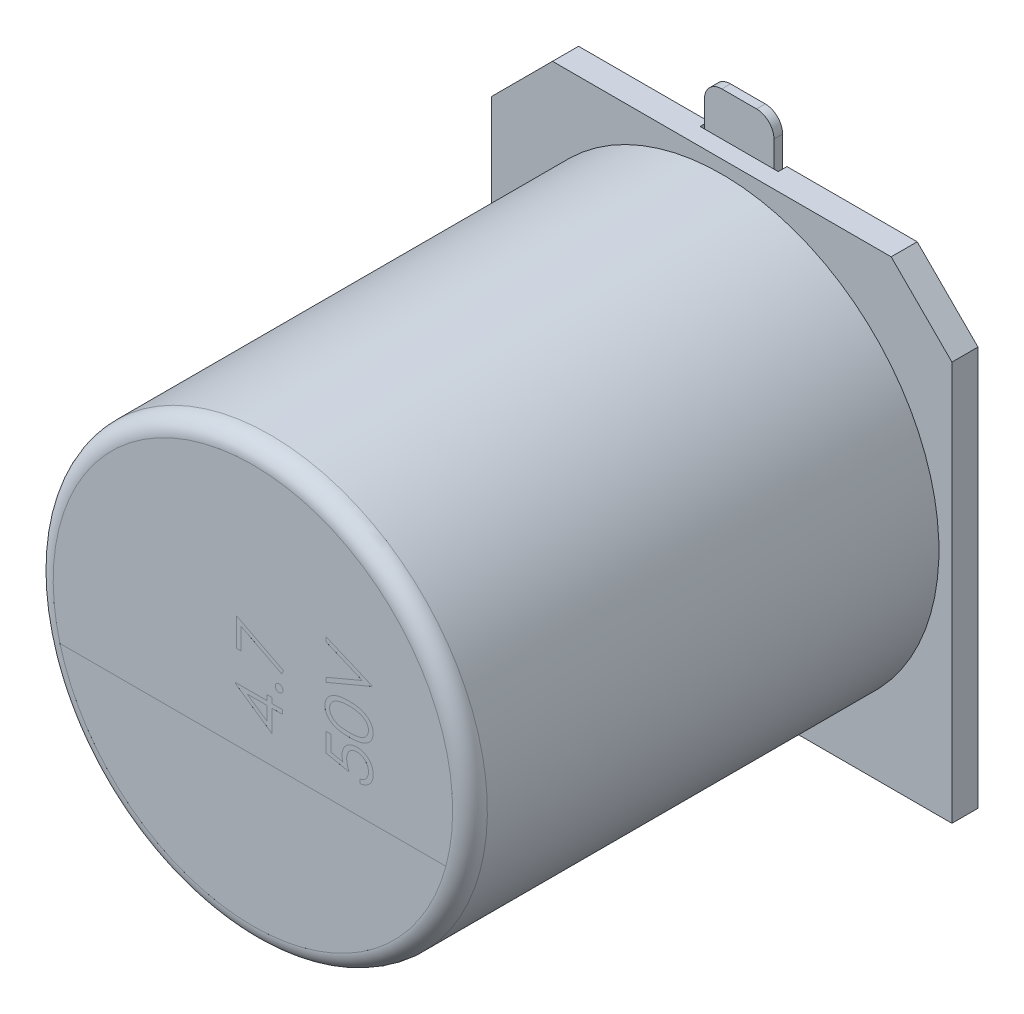
from build123d import *

# Parameters (mm, degrees)
RESSALTO_EXTRUS_O1_DEPTH   = 0.3
ESBO_O2_R                  = 2.5
RESSALTO_EXTRUS_O2_DEPTH   = 5.4
FILETE1_R                  = 0.2
CORTE_EXTRUS_O1_DEPTH      = 0.0001
CORTE_EXTRUS_O2_DEPTH      = 0.0001
ESBO_O5_W                  = 0.9
ESBO_O5_H                  = 2.1
CORTE_EXTRUS_O3_DEPTH      = 0.1
RESSALTO_EXTRUS_O3_DEPTH   = 0.1
RESSALTO_EXTRUS_O3_2_DEPTH = 0.1


with BuildPart() as part:
    # Esboço1 → Ressalto-extrusão1 (new body)
    with BuildSketch(Plane.XY):
        Polygon((-2.65, 1.95), (-1.95, 2.65), (1.95, 2.65), (2.65, 1.95), (2.65, -2.65), (-2.65, -2.65), align=None)
    extrude(amount=RESSALTO_EXTRUS_O1_DEPTH)

    # Esboço5 → Corte-extrusão3 (cut)
    with BuildSketch(Plane(origin=(0, 0, 0), x_dir=(-1, 0, 0), z_dir=(0, 0, -1))):
        with Locations((0, 2.1)):
            Rectangle(ESBO_O5_W, ESBO_O5_H)
        with Locations((0, -2.1)):
            Rectangle(ESBO_O5_W, ESBO_O5_H)
    extrude(amount=-CORTE_EXTRUS_O3_DEPTH, mode=Mode.SUBTRACT)


with BuildPart() as body_2:
    # Esboço2 → Ressalto-extrusão2 (new body)
    with BuildSketch(Plane.XY.offset(0.3)):
        with Locations(Location((0, 0, 0), (0, 0, 180))):
            Circle(ESBO_O2_R)
    extrude(amount=RESSALTO_EXTRUS_O2_DEPTH)

    # Filete1
    filete1_edges = [body_2.edges().sort_by_distance(p)[0] for p in [
        (2.5, 0, 5.7),
    ]]
    fillet(filete1_edges, radius=FILETE1_R)

    # Esboço3 → Corte-extrusão1 (cut)
    with BuildSketch(Plane.XY.offset(5.7)):
        with BuildLine():
            Line((-2.222466614, -0.592150444), (2.222466614, -0.592150444))
            ThreePointArc((2.222466614, -0.592150444), (0, -2.3), (-2.222466614, -0.592150444))
        make_face()
    extrude(amount=-CORTE_EXTRUS_O1_DEPTH, mode=Mode.SUBTRACT)

    # Esboço4 → Corte-extrusão2 (cut)
    # profile 1 of 6: a face of its own
    with BuildSketch(Plane.XY.offset(5.7)):
        Polygon((-0.203365217, 0.020093001), (-0.203365217, 0.029739268), (0.162980937, 0.029739268), (0.162980937, 0.090796961), (0.217254441, 0.090796961), (0.217254441, 0.029739268), (0.339369825, 0.029739268), (0.339369825, -0.017750048), (0.217254441, -0.017750048), (0.217254441, -0.268765005), align=None)
        Polygon((0.162980937, -0.017750048), (-0.066833433, -0.017750048), (0.162980937, -0.17548242), align=None, mode=Mode.SUBTRACT)
    # profile 2 of 6: a face of its own
    with BuildSketch(Plane.XY.offset(5.7)):
        with BuildLine():
            add(Edge.make_bspline(
                [(0.257959569, 0.223088627), (0.258134673, 0.226035362), (0.258477943, 0.23181209), (0.260832988, 0.24016372), (0.265014714, 0.247722437), (0.270588015, 0.254455288), (0.277345574, 0.260004958), (0.284844003, 0.264335711), (0.293265553, 0.266670241), (0.299075754, 0.267011011), (0.302056791, 0.267185849)],
                knots=[0, 0, 0, 0, 1.020151414, 1.999887582, 2.974338812, 3.990962822, 5.007586832, 5.987933904, 6.967670073, 8, 8, 8, 8], degree=3))
            add(Edge.make_bspline(
                [(0.302056791, 0.267185849), (0.304966699, 0.267005643), (0.310704994, 0.266650278), (0.319055795, 0.264334657), (0.326562824, 0.260010215), (0.333304543, 0.254419978), (0.339012458, 0.247762701), (0.343138744, 0.240140072), (0.345670514, 0.231833209), (0.345990876, 0.226039143), (0.346154014, 0.223088627)],
                knots=[0, 0, 0, 0, 1.009624703, 1.990965087, 2.972917375, 3.991206001, 5.017354006, 5.993400798, 6.978178195, 8, 8, 8, 8], degree=3))
            add(Edge.make_bspline(
                [(0.346154014, 0.223088627), (0.345996798, 0.220135986), (0.345689871, 0.214371658), (0.343086996, 0.206095765), (0.339051833, 0.198426675), (0.333294152, 0.191771129), (0.326597696, 0.186135591), (0.319004095, 0.182003004), (0.310728926, 0.17948661), (0.304971413, 0.179157839), (0.302056791, 0.178991405)],
                knots=[0, 0, 0, 0, 1.022258411, 1.995716197, 2.98297171, 4.009558169, 5.028281891, 6.00474573, 6.989943903, 8, 8, 8, 8], degree=3))
            add(Edge.make_bspline(
                [(0.302056791, 0.178991405), (0.299070873, 0.179151984), (0.293241235, 0.179465496), (0.284895655, 0.182001816), (0.277310665, 0.186140838), (0.270598325, 0.191735701), (0.264975959, 0.198467351), (0.26088402, 0.206071658), (0.258458862, 0.214393112), (0.258128887, 0.220139853), (0.257959569, 0.223088627)],
                knots=[0, 0, 0, 0, 1.032775665, 2.016367738, 2.991239715, 4.008302682, 5.025365648, 6.011011707, 6.979408107, 8, 8, 8, 8], degree=3))
        make_face()
    # profile 3 of 6: a face of its own
    with BuildSketch(Plane.XY.offset(5.7)):
        Polygon((-0.189796841, 0.375732858), (-0.189796841, 0.701373884), (0.352938202, 0.423222174), (0.330359576, 0.382199037), (-0.135523337, 0.621023657), (-0.135523337, 0.375732858), align=None)
    # profile 4 of 6: a face of its own
    with BuildSketch(Plane.XY.offset(5.7)):
        with BuildLine():
            Line((0.842444364, 0.063660208), (0.896717868, 0.063660208))
            Line((0.896717868, 0.063660208), (0.896717868, -0.11633278))
            Line((0.896717868, -0.11633278), (1.035899726, -0.144847571))
            add(Edge.make_bspline(
                [(1.035899726, -0.144847571), (1.034353006, -0.139245075), (1.031356482, -0.128391127), (1.028029419, -0.112371005), (1.02602381, -0.097162422), (1.025749957, -0.087293408), (1.025617441, -0.082517843)],
                knots=[0, 0, 0, 0, 1.100273476, 2.13160584, 3.095893838, 4, 4, 4, 4], degree=3))
            add(Edge.make_bspline(
                [(1.025617441, -0.082517843), (1.025741115, -0.076607669), (1.025984288, -0.064986791), (1.02845794, -0.048010473), (1.032040823, -0.031723126), (1.037560934, -0.01636523), (1.044301973, -0.001693809), (1.05279246, 0.012039174), (1.062705081, 0.025026463), (1.073988787, 0.037178294), (1.086536178, 0.048150641), (1.100082924, 0.057685248), (1.114333412, 0.066007191), (1.129621644, 0.07249756), (1.145659278, 0.077794334), (1.162631445, 0.08128704), (1.180387467, 0.083620017), (1.192528895, 0.083880131), (1.198720239, 0.084012772)],
                knots=[0, 0, 0, 0, 1.052805225, 2.070078116, 3.052532748, 4.020689046, 4.973125432, 5.925915817, 6.89216474, 7.881560752, 8.877013184, 9.857446635, 10.830895175, 11.812622661, 12.812548702, 13.836681939, 14.896847428, 16, 16, 16, 16], degree=3))
            add(Edge.make_bspline(
                [(1.198720239, 0.084012772), (1.2030325, 0.083912129), (1.211598746, 0.083712202), (1.224320942, 0.082697743), (1.236771949, 0.080737046), (1.248928938, 0.078136552), (1.260803296, 0.074665021), (1.272461506, 0.070604435), (1.283775913, 0.065557394), (1.294796487, 0.059962186), (1.305397101, 0.053766548), (1.315323587, 0.046799691), (1.324802469, 0.039560724), (1.333552239, 0.031650817), (1.341606835, 0.023159901), (1.349006078, 0.014135219), (1.355882762, 0.004658627), (1.361955718, -0.00541913), (1.36754419, -0.015872782), (1.372128813, -0.026853486), (1.376227669, -0.038111232), (1.379494823, -0.049808065), (1.382054864, -0.061917487), (1.383793646, -0.074459459), (1.385060083, -0.087368203), (1.385139361, -0.096118354), (1.385179407, -0.100538343)],
                knots=[0, 0, 0, 0, 1.056393913, 2.098511576, 3.122979385, 4.141471433, 5.141222888, 6.151259816, 7.162667642, 8.172852865, 9.177685681, 10.166741883, 11.141342384, 12.097242845, 13.052202613, 14.005160326, 14.953864445, 15.917140761, 16.884916217, 17.854238259, 18.828761908, 19.81781811, 20.826036654, 21.857789401, 22.917898972, 24, 24, 24, 24], degree=3))
            add(Edge.make_bspline(
                [(1.385179407, -0.100538343), (1.385074678, -0.105810852), (1.384868636, -0.116183892), (1.38272294, -0.131383561), (1.379629488, -0.145998889), (1.37504637, -0.159967238), (1.369045104, -0.173230351), (1.361914692, -0.185978154), (1.353426046, -0.198052642), (1.343656808, -0.209371266), (1.332922474, -0.219775591), (1.321385167, -0.229210309), (1.309030195, -0.237505169), (1.295897732, -0.244690258), (1.282011072, -0.2508113), (1.267327427, -0.25562194), (1.251920999, -0.259504121), (1.241314473, -0.261146586), (1.23592727, -0.261980817)],
                knots=[0, 0, 0, 0, 1.046872515, 2.059598001, 3.044168548, 4.012104806, 4.973680974, 5.932408326, 6.910122221, 7.900780896, 8.89867654, 9.876692837, 10.858029398, 11.85084981, 12.847361615, 13.868568023, 14.917415949, 16, 16, 16, 16], degree=3))
            Line((1.23592727, -0.261980817), (1.23592727, -0.214491501))
            add(Edge.make_bspline(
                [(1.23592727, -0.214491501), (1.240973997, -0.213323748), (1.250674087, -0.211079261), (1.264294096, -0.206139854), (1.276435474, -0.200159218), (1.287172456, -0.192881825), (1.29670158, -0.184446395), (1.305103388, -0.174640644), (1.312692514, -0.163709711), (1.319029286, -0.151556661), (1.324367161, -0.138710299), (1.328176444, -0.125341569), (1.330482285, -0.111642872), (1.330764165, -0.102419857), (1.330905902, -0.097782266)],
                knots=[0, 0, 0, 0, 1.13623081, 2.183898708, 3.172478118, 4.09966615, 5.022692284, 5.957376522, 6.927682873, 7.937366477, 8.960015386, 9.976409503, 10.982481913, 12, 12, 12, 12], degree=3))
            add(Edge.make_bspline(
                [(1.330905902, -0.097782266), (1.33078077, -0.093253219), (1.330534384, -0.084335488), (1.328668617, -0.071204922), (1.325719642, -0.058564906), (1.321588298, -0.046393003), (1.316122772, -0.034749023), (1.309408687, -0.023649429), (1.301613556, -0.012936098), (1.292704005, -0.002890989), (1.282880098, 0.006306872), (1.272376067, 0.014434412), (1.26117023, 0.021204222), (1.249457047, 0.026909268), (1.237108022, 0.031241372), (1.22418106, 0.034331854), (1.210644223, 0.036146602), (1.201411125, 0.036396245), (1.196706183, 0.036523456)],
                knots=[0, 0, 0, 0, 1.027268864, 2.022700798, 3.002744649, 3.968653148, 4.933396556, 5.915045722, 6.907600446, 7.935526002, 8.956456544, 9.95700807, 10.942805781, 11.92166854, 12.907987664, 13.905483474, 14.932689774, 16, 16, 16, 16], degree=3))
            add(Edge.make_bspline(
                [(1.196706183, 0.036523456), (1.192460895, 0.036426925), (1.18418639, 0.036238777), (1.172038136, 0.034609986), (1.160525166, 0.031889117), (1.149597383, 0.028015151), (1.139289726, 0.023180319), (1.129624911, 0.01711004), (1.120512064, 0.010062793), (1.112185695, 0.001835292), (1.104488742, -0.007114526), (1.097951086, -0.017016539), (1.092391341, -0.027606398), (1.087836113, -0.038903729), (1.084207525, -0.050922448), (1.081699758, -0.063669027), (1.080199148, -0.077146372), (1.079995583, -0.086365308), (1.079890945, -0.091104081)],
                knots=[0, 0, 0, 0, 1.045723156, 2.038222538, 3.013889863, 3.95567481, 4.890389958, 5.81331128, 6.76251276, 7.723027653, 8.692928204, 9.666105983, 10.639751036, 11.635719707, 12.66315958, 13.728667616, 14.832476222, 16, 16, 16, 16], degree=3))
            add(Edge.make_bspline(
                [(1.079890945, -0.091104081), (1.079978725, -0.095205717), (1.080159968, -0.103674554), (1.08149445, -0.116665267), (1.083647296, -0.130316516), (1.08660855, -0.144575969), (1.090483725, -0.159486451), (1.095127465, -0.175016495), (1.100679481, -0.191198754), (1.104872328, -0.202102267), (1.107027697, -0.207707313)],
                knots=[0, 0, 0, 0, 0.817624296, 1.688186739, 2.600797293, 3.572016777, 4.590301741, 5.671205678, 6.80286297, 8, 8, 8, 8], degree=3))
            Line((1.107027697, -0.207707313), (0.842444364, -0.153433809))
            Line((0.842444364, -0.153433809), (0.842444364, 0.063660208))
        make_face()
    # profile 5 of 6: a face of its own
    with BuildSketch(Plane.XY.offset(5.7)):
        with BuildLine():
            add(Edge.make_bspline(
                [(1.107239703, 0.138286277), (1.098758312, 0.13833587), (1.082283089, 0.138432206), (1.058276363, 0.139503907), (1.035754986, 0.141284227), (1.01471788, 0.143724044), (0.995159613, 0.146693119), (0.977132454, 0.150656652), (0.960552962, 0.15516406), (0.945367095, 0.160388074), (0.93137018, 0.166282612), (0.918303681, 0.172698425), (0.906186386, 0.179889212), (0.894828405, 0.187447235), (0.884403204, 0.195666727), (0.874790666, 0.204371446), (0.866071856, 0.213735488), (0.858240803, 0.22366803), (0.851374112, 0.234101754), (0.845288446, 0.244751547), (0.840275716, 0.255807695), (0.836175164, 0.267124652), (0.832827789, 0.278726269), (0.830528486, 0.290609584), (0.82908434, 0.302802144), (0.828946098, 0.31103161), (0.828875988, 0.31520518)],
                knots=[0, 0, 0, 0, 1.646148282, 3.197666765, 4.66315463, 6.030252048, 7.307778049, 8.501004361, 9.610818041, 10.641065266, 11.615491391, 12.557119604, 13.464013759, 14.348536654, 15.203310953, 16.038349431, 16.863300206, 17.683791446, 18.490318933, 19.285717724, 20.06220424, 20.843281102, 21.620494212, 22.403315558, 23.190242141, 24, 24, 24, 24], degree=3))
            add(Edge.make_bspline(
                [(0.828875988, 0.31520518), (0.828934385, 0.319415681), (0.829050575, 0.327793094), (0.830686021, 0.340134039), (0.832796937, 0.352260026), (0.8361825, 0.363987079), (0.840233765, 0.375536935), (0.845579344, 0.386622372), (0.851393077, 0.397634765), (0.858485342, 0.408073835), (0.866323462, 0.418251482), (0.875221732, 0.427791963), (0.884933892, 0.43693916), (0.89567655, 0.445347585), (0.907284991, 0.453377612), (0.919856526, 0.460724413), (0.933363295, 0.467540788), (0.947742682, 0.473954867), (0.963378785, 0.47956381), (0.980174075, 0.484550608), (0.998280642, 0.488638133), (1.017597622, 0.492018445), (1.038220711, 0.49464221), (1.060108122, 0.496551742), (1.083273551, 0.497560763), (1.099111945, 0.497750748), (1.107239703, 0.497848243)],
                knots=[0, 0, 0, 0, 0.810910589, 1.61342667, 2.396193133, 3.181089899, 3.963115317, 4.752255436, 5.550715454, 6.36105385, 7.181178335, 8.024612154, 8.872680183, 9.750181803, 10.651284446, 11.591556747, 12.554036451, 13.566402641, 14.62422919, 15.753422176, 16.94128843, 18.199818041, 19.531985927, 20.947085226, 22.433341622, 24, 24, 24, 24], degree=3))
            add(Edge.make_bspline(
                [(1.107239703, 0.497848243), (1.115331938, 0.497748603), (1.131134621, 0.497554026), (1.154196903, 0.496573382), (1.175966337, 0.494595569), (1.196466132, 0.492157664), (1.215705794, 0.488739572), (1.233672785, 0.484621052), (1.250430717, 0.479928612), (1.265859521, 0.474233587), (1.280213956, 0.467968801), (1.293621411, 0.46115974), (1.306189626, 0.453854399), (1.317828685, 0.445944803), (1.328528225, 0.437398069), (1.338273695, 0.428257284), (1.347228562, 0.418633502), (1.355153035, 0.408396521), (1.362299297, 0.397860218), (1.368324007, 0.386846707), (1.373544064, 0.375637853), (1.377811943, 0.364121747), (1.381121733, 0.352316168), (1.383397033, 0.34018187), (1.384996394, 0.327791352), (1.385118191, 0.319415098), (1.385179407, 0.31520518)],
                knots=[0, 0, 0, 0, 1.561645053, 3.049612875, 4.452756685, 5.778837748, 7.032101753, 8.221335837, 9.334924186, 10.387562255, 11.392109817, 12.355697819, 13.287721948, 14.19548756, 15.068665045, 15.927346723, 16.771751757, 17.602390507, 18.423119567, 19.225778204, 20.022010933, 20.807278863, 21.593079439, 22.384715467, 23.188155646, 24, 24, 24, 24], degree=3))
            add(Edge.make_bspline(
                [(1.385179407, 0.31520518), (1.385108898, 0.311031701), (1.384969869, 0.302802415), (1.383531484, 0.290608536), (1.381218949, 0.278772977), (1.377980963, 0.267237331), (1.374017528, 0.255942419), (1.368853821, 0.245042141), (1.362906867, 0.234415338), (1.356134292, 0.224090207), (1.348374689, 0.214261362), (1.339793434, 0.204871217), (1.330170473, 0.196164351), (1.319657311, 0.18801613), (1.30828243, 0.180378205), (1.296038198, 0.173249555), (1.282903707, 0.166699198), (1.268796174, 0.160703953), (1.253502524, 0.155388499), (1.236880769, 0.150711419), (1.218762082, 0.146975979), (1.199238453, 0.143809615), (1.178270214, 0.141272367), (1.155849778, 0.139504647), (1.132019719, 0.138433019), (1.115650439, 0.138336083), (1.107239703, 0.138286277)],
                knots=[0, 0, 0, 0, 0.810927267, 1.598990287, 2.382942141, 3.152806972, 3.926217614, 4.706701772, 5.493896336, 6.292070767, 7.104102563, 7.925577746, 8.761822141, 9.623241997, 10.509042271, 11.423174113, 12.375371989, 13.360203808, 14.400680605, 15.520553799, 16.714061498, 17.994519714, 19.364400916, 20.818312473, 22.365209998, 24, 24, 24, 24], degree=3))
        make_face()
        with BuildLine():
            add(Edge.make_bspline(
                [(1.107027697, 0.185775593), (1.114095627, 0.185794048), (1.127813091, 0.185829866), (1.147711696, 0.186738507), (1.166302309, 0.188003242), (1.183577673, 0.189594352), (1.199477412, 0.191977265), (1.214067627, 0.194680826), (1.22732131, 0.197923582), (1.239354285, 0.201779263), (1.250336942, 0.206171259), (1.260562008, 0.210958128), (1.27015067, 0.216146154), (1.279079664, 0.221841681), (1.287239843, 0.228157314), (1.294838048, 0.234800259), (1.301610021, 0.242069777), (1.309733298, 0.252124062), (1.318127126, 0.265398264), (1.325436636, 0.282122959), (1.330030163, 0.299308563), (1.330614328, 0.310973095), (1.330905902, 0.316795224)],
                knots=[0, 0, 0, 0, 1.459098681, 2.831824031, 4.11146945, 5.306290378, 6.412266529, 7.42953815, 8.369053297, 9.227277979, 10.03601793, 10.809473603, 11.557037441, 12.285528272, 12.993193355, 13.685654407, 14.36688038, 15.041354379, 16.352855396, 17.594313975, 18.799247529, 20, 20, 20, 20], degree=3))
            add(Edge.make_bspline(
                [(1.330905902, 0.316795224), (1.330650594, 0.322651056), (1.330140883, 0.334341947), (1.325692325, 0.351511764), (1.318460382, 0.368042399), (1.310198059, 0.381088202), (1.302279202, 0.390985674), (1.295535399, 0.398079667), (1.287982129, 0.404590074), (1.279833185, 0.410765053), (1.270932194, 0.416428495), (1.261322147, 0.421578521), (1.250976304, 0.426278026), (1.243753975, 0.428955465), (1.240061385, 0.430324371)],
                knots=[0, 0, 0, 0, 1.353621445, 2.702441307, 4.075953605, 5.516772412, 6.261413105, 7.007624062, 7.778524365, 8.566925914, 9.372323995, 10.217594641, 11.088702136, 12, 12, 12, 12], degree=3))
            add(Edge.make_bspline(
                [(1.240061385, 0.430324371), (1.235339745, 0.431919698), (1.225752793, 0.435158895), (1.210881146, 0.439333533), (1.195277871, 0.44262123), (1.179036216, 0.445579025), (1.162036404, 0.447597879), (1.144331034, 0.449222846), (1.125906757, 0.450179986), (1.113388943, 0.450298633), (1.107027697, 0.450358926)],
                knots=[0, 0, 0, 0, 0.884706709, 1.796334032, 2.740027952, 3.714592787, 4.726048262, 5.777819803, 6.87074269, 8, 8, 8, 8], degree=3))
            add(Edge.make_bspline(
                [(1.107027697, 0.450358926), (1.100667481, 0.450275743), (1.088225538, 0.450113018), (1.070004337, 0.449491023), (1.052697902, 0.447884839), (1.036231676, 0.446100925), (1.020696808, 0.443470631), (1.005963251, 0.440634628), (0.992213528, 0.436824449), (0.979232392, 0.432754421), (0.967167241, 0.428096233), (0.955962121, 0.422968324), (0.945561902, 0.417492544), (0.93599872, 0.411542256), (0.927217104, 0.405200342), (0.919419117, 0.398239416), (0.912225431, 0.391101548), (0.904160778, 0.380949996), (0.895873016, 0.367767896), (0.888453587, 0.351251764), (0.884062569, 0.334158279), (0.883453632, 0.322578736), (0.883149492, 0.316795224)],
                knots=[0, 0, 0, 0, 1.313483664, 2.569454835, 3.763100662, 4.901599063, 5.988328865, 7.015709358, 7.99797933, 8.932480776, 9.824041341, 10.666387587, 11.475829342, 12.24921787, 12.990555181, 13.709176526, 14.405678811, 15.080244297, 16.38186033, 17.610124501, 18.806354173, 20, 20, 20, 20], degree=3))
            add(Edge.make_bspline(
                [(0.883149492, 0.316795224), (0.883454388, 0.310941662), (0.884064736, 0.299223875), (0.88843328, 0.281947848), (0.895851308, 0.265320139), (0.904144811, 0.25209457), (0.91219451, 0.242066342), (0.919045732, 0.234950076), (0.926462457, 0.228215002), (0.934695026, 0.222062912), (0.943592558, 0.216401158), (0.953057222, 0.211012633), (0.963301394, 0.206289778), (0.974275439, 0.201883681), (0.986309076, 0.198021569), (0.999610716, 0.194815865), (1.014235773, 0.191897451), (1.030251684, 0.189795717), (1.047530735, 0.187945), (1.06616889, 0.186752392), (1.086135826, 0.185825704), (1.099924262, 0.185792631), (1.107027697, 0.185775593)],
                knots=[0, 0, 0, 0, 1.207546505, 2.417292871, 3.651582144, 4.952510111, 5.626719005, 6.30238548, 6.989136872, 7.692112372, 8.420316868, 9.164734959, 9.937886623, 10.746308695, 11.604196049, 12.543341915, 13.568754172, 14.680483261, 15.875568977, 17.154711427, 18.534182925, 20, 20, 20, 20], degree=3))
        make_face(mode=Mode.SUBTRACT)
    # profile 6 of 6: a face of its own
    with BuildSketch(Plane.XY.offset(5.7)):
        Polygon((0.842444364, 0.552121747), (0.842444364, 0.603003157), (1.259459922, 0.779392046), (0.842444364, 0.955780935), (0.842444364, 1.006662345), (1.371611031, 0.78278414), (1.371611031, 0.775999952), align=None)
    extrude(amount=-CORTE_EXTRUS_O2_DEPTH, mode=Mode.SUBTRACT)


with BuildPart() as body_3:
    # Esboço6 → Ressalto-extrusão3 (new body)
    with BuildSketch(Plane(origin=(0, 0, 0.1), x_dir=(-1, 0, 0), z_dir=(0, 0, -1))):
        with BuildLine():
            Line((-0.2, 3.15), (0.2, 3.15))
            ThreePointArc((0.2, 3.15), (0.341421356, 3.091421356), (0.4, 2.95))
            Line((0.4, 2.95), (0.4, 1.05))
            Line((0.4, 1.05), (-0.4, 1.05))
            Line((-0.4, 1.05), (-0.4, 2.95))
            ThreePointArc((-0.4, 2.95), (-0.341421356, 3.091421356), (-0.2, 3.15))
        make_face()
    extrude(amount=RESSALTO_EXTRUS_O3_DEPTH)


with BuildPart() as body_4:
    # Esboço6 → Ressalto-extrus_o3 2 (new body)
    with BuildSketch(Plane(origin=(0, 0, 0.1), x_dir=(-1, 0, 0), z_dir=(0, 0, -1))):
        with BuildLine():
            Line((-0.4, -1.05), (0.4, -1.05))
            Line((0.4, -1.05), (0.4, -2.95))
            ThreePointArc((0.4, -2.95), (0.341421356, -3.091421356), (0.2, -3.15))
            Line((0.2, -3.15), (-0.2, -3.15))
            ThreePointArc((-0.2, -3.15), (-0.341421356, -3.091421356), (-0.4, -2.95))
            Line((-0.4, -2.95), (-0.4, -1.05))
        make_face()
    extrude(amount=RESSALTO_EXTRUS_O3_2_DEPTH)


solid = Compound([part.part, body_2.part, body_3.part, body_4.part])
